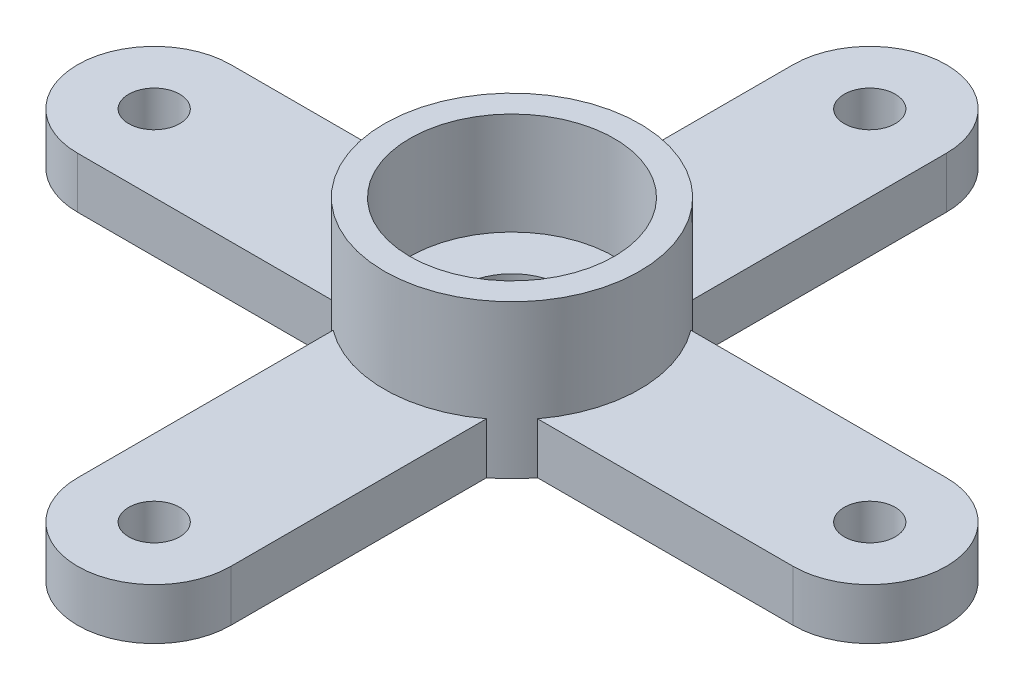
from build123d import *

# Parameters (mm, degrees)
SKETCH4_R           = 0.5
SKETCH4_R_2         = 1
BOSS_EXTRUDE1_DEPTH = 1
SKETCH4_3_R         = 2.5
SKETCH4_3_R_2       = 2
BOSS_EXTRUDE2_DEPTH = 3


with BuildPart() as part:
    # Sketch4 → Boss-Extrude1 (new body)
    with BuildSketch(Plane(origin=(0, 0, 0), x_dir=(1, 0, 0), z_dir=(0, 1, 0))):
        with BuildLine():
            Line((2, -1.5), (7, -1.5))
            ThreePointArc((7, -1.5), (8.5, 0), (7, 1.5))
            Line((7, 1.5), (2, 1.5))
            ThreePointArc((2, 1.5), (1.767766953, 1.767766953), (1.5, 2))
            Line((1.5, 2), (1.5, 7))
            ThreePointArc((1.5, 7), (0, 8.5), (-1.5, 7))
            Line((-1.5, 7), (-1.5, 2))
            ThreePointArc((-1.5, 2), (-1.767766953, 1.767766953), (-2, 1.5))
            Line((-2, 1.5), (-7, 1.5))
            ThreePointArc((-7, 1.5), (-8.5, 0), (-7, -1.5))
            Line((-7, -1.5), (-2, -1.5))
            ThreePointArc((-2, -1.5), (-1.767766953, -1.767766953), (-1.5, -2))
            Line((-1.5, -2), (-1.5, -7))
            ThreePointArc((-1.5, -7), (0, -8.5), (1.5, -7))
            Line((1.5, -7), (1.5, -2))
            ThreePointArc((1.5, -2), (1.767766953, -1.767766953), (2, -1.5))
        make_face()
        with Locations((7, 0)):
            Circle(SKETCH4_R, mode=Mode.SUBTRACT)
        Circle(SKETCH4_R_2, mode=Mode.SUBTRACT)
        with Locations((0, -7)):
            Circle(SKETCH4_R, mode=Mode.SUBTRACT)
        with Locations((-7, 0)):
            Circle(SKETCH4_R, mode=Mode.SUBTRACT)
        with Locations((0, 7)):
            Circle(SKETCH4_R, mode=Mode.SUBTRACT)
    extrude(amount=BOSS_EXTRUDE1_DEPTH)

    # Sketch4<3> → Boss-Extrude2 (add)
    with BuildSketch(Plane(origin=(0, 0, 0), x_dir=(1, 0, 0), z_dir=(0, 1, 0))):
        Circle(SKETCH4_3_R)
        Circle(SKETCH4_3_R_2, mode=Mode.SUBTRACT)
    extrude(amount=BOSS_EXTRUDE2_DEPTH)


solid = part.part
